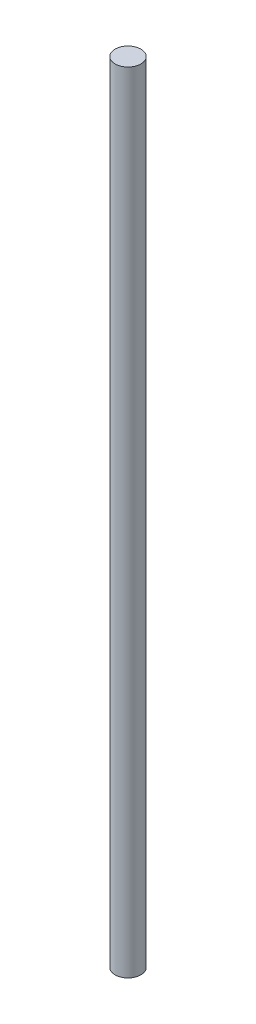
from build123d import *

# Parameters (mm, degrees)
SKETCH1_R           = 4
BOSS_EXTRUDE1_DEPTH = 245


with BuildPart() as part:
    # Sketch1 → Boss-Extrude1 (new body)
    with BuildSketch(Plane(origin=(0, 0, 0), x_dir=(1, 0, 0), z_dir=(0, 1, 0))):
        with Locations(Location((0, 0, 0), (0, 0, 270))):
            Circle(SKETCH1_R)
    extrude(amount=BOSS_EXTRUDE1_DEPTH)


solid = part.part
